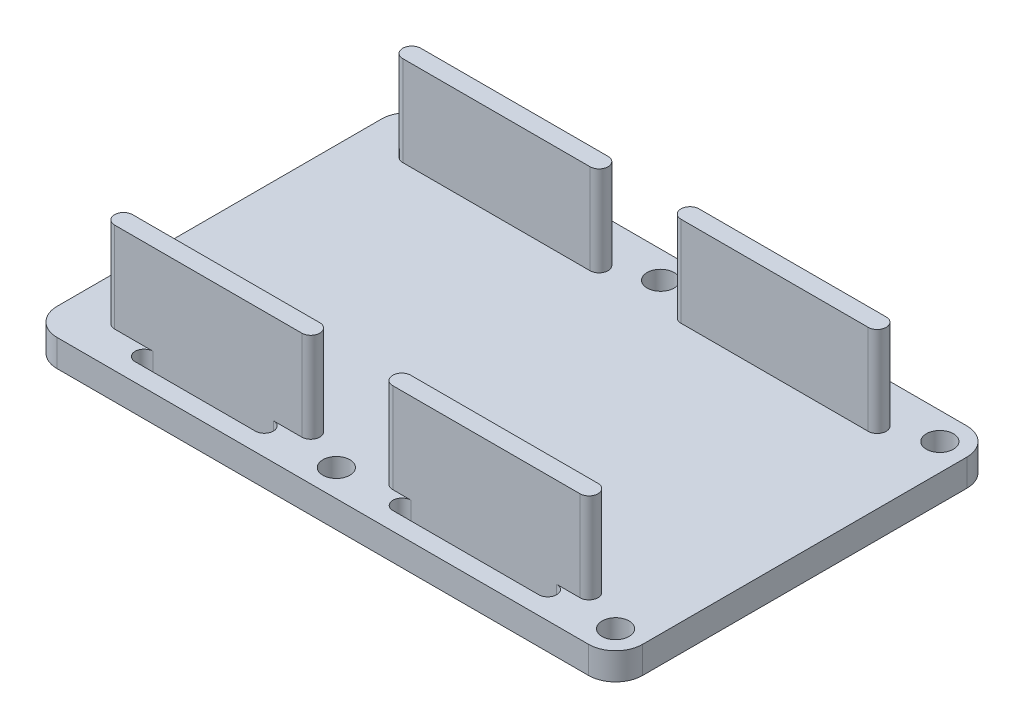
from build123d import *

# Parameters (mm, degrees)
SKETCH1_R           = 1.5
BOSS_EXTRUDE1_DEPTH = 3
BOSS_EXTRUDE2_DEPTH = 10


with BuildPart() as part:
    # Sketch1 → Boss-Extrude1 (new body)
    with BuildSketch(Plane(origin=(0, 0, 0), x_dir=(1, 0, 0), z_dir=(0, 1, 0))):
        with BuildLine():
            Line((0, -21), (31, -21))
            ThreePointArc((31, -21), (33.121320344, -20.121320344), (34, -18))
            Line((34, -18), (34, 18))
            ThreePointArc((34, 18), (33.121320344, 20.121320344), (31, 21))
            Line((31, 21), (0, 21))
            Line((0, 21), (-28, 21))
            ThreePointArc((-28, 21), (-30.121320344, 20.121320344), (-31, 18))
            Line((-31, 18), (-31, -18))
            ThreePointArc((-31, -18), (-30.121320344, -20.121320344), (-28, -21))
            Line((-28, -21), (0, -21))
        make_face()
        with Locations(Location((0, 18, 0), (0, 0, 270))):
            Circle(SKETCH1_R, mode=Mode.SUBTRACT)
        with Locations(Location((31, 18, 0), (0, 0, 270))):
            Circle(SKETCH1_R, mode=Mode.SUBTRACT)
        with Locations(Location((31, -18, 0), (0, 0, 270))):
            Circle(SKETCH1_R, mode=Mode.SUBTRACT)
        with Locations(Location((0, -18, 0), (0, 0, 270))):
            Circle(SKETCH1_R, mode=Mode.SUBTRACT)
        with BuildLine():
            Line((-21.341863145, 17), (-7.990756516, 17))
            ThreePointArc((-7.990756516, 17), (-6.990756516, 18), (-7.990756516, 19))
            Line((-7.990756516, 19), (-21.341863145, 19))
            ThreePointArc((-21.341863145, 19), (-22.341863145, 18), (-21.341863145, 17))
        make_face(mode=Mode.SUBTRACT)
        with BuildLine():
            Line((7.282100309, 17), (23.465259859, 17))
            ThreePointArc((23.465259859, 17), (24.465259859, 18), (23.465259859, 19))
            Line((23.465259859, 19), (7.282100309, 19))
            ThreePointArc((7.282100309, 19), (6.282100309, 18), (7.282100309, 17))
        make_face(mode=Mode.SUBTRACT)
        with BuildLine():
            Line((-21.341863145, -19), (-7.990756516, -19))
            ThreePointArc((-7.990756516, -19), (-6.990756516, -18), (-7.990756516, -17))
            Line((-7.990756516, -17), (-21.341863145, -17))
            ThreePointArc((-21.341863145, -17), (-22.341863145, -18), (-21.341863145, -19))
        make_face(mode=Mode.SUBTRACT)
        with BuildLine():
            Line((7.282100309, -19), (23.465259859, -19))
            ThreePointArc((23.465259859, -19), (24.465259859, -18), (23.465259859, -17))
            Line((23.465259859, -17), (7.282100309, -17))
            ThreePointArc((7.282100309, -17), (6.282100309, -18), (7.282100309, -19))
        make_face(mode=Mode.SUBTRACT)
    extrude(amount=BOSS_EXTRUDE1_DEPTH)

    # Sketch2 → Boss-Extrude2 (add)
    with BuildSketch(Plane(origin=(0, 3, 0), x_dir=(1, 0, 0), z_dir=(0, 1, 0))):
        with BuildLine():
            Line((-4.836170767, -15), (-25.624305917, -15))
            ThreePointArc((-25.624305917, -15), (-26.624305917, -16), (-25.624305917, -17))
            Line((-25.624305917, -17), (-4.836170767, -17))
            ThreePointArc((-4.836170767, -17), (-3.836170767, -16), (-4.836170767, -15))
        make_face()
        with BuildLine():
            ThreePointArc((-25.624305917, 17), (-26.624305917, 16), (-25.624305917, 15))
            Line((-25.624305917, 15), (-4.836170767, 15))
            ThreePointArc((-4.836170767, 15), (-3.836170767, 16), (-4.836170767, 17))
            Line((-4.836170767, 17), (-25.624305917, 17))
        make_face()
        with BuildLine():
            Line((26.046785566, -15), (5.262345151, -15))
            ThreePointArc((5.262345151, -15), (4.262345151, -16), (5.262345151, -17))
            Line((5.262345151, -17), (26.046785566, -17))
            ThreePointArc((26.046785566, -17), (27.046785566, -16), (26.046785566, -15))
        make_face()
        with BuildLine():
            ThreePointArc((5.262345151, 17), (4.262345151, 16), (5.262345151, 15))
            Line((5.262345151, 15), (26.046785566, 15))
            ThreePointArc((26.046785566, 15), (27.046785566, 16), (26.046785566, 17))
            Line((26.046785566, 17), (5.262345151, 17))
        make_face()
    extrude(amount=BOSS_EXTRUDE2_DEPTH)


solid = part.part
